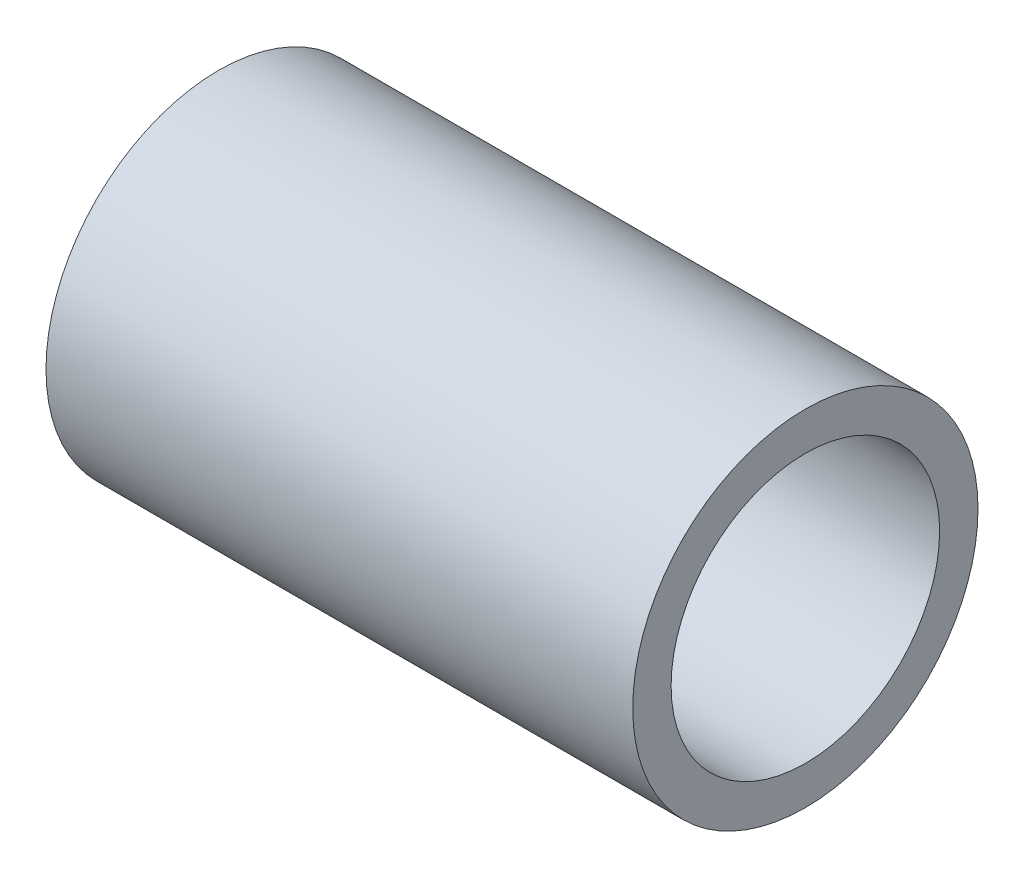
from build123d import *


with BuildPart() as part:
    # Sketch1 → Revolve1 (revolve)
    with BuildSketch(Plane.XY, mode=Mode.PRIVATE) as revolve1_sk:
        with BuildLine():
            Line((6.35, 14.2875), (54.912326353, 14.2875))
            Line((54.912326353, 14.2875), (54.912326353, 11.1125))
            Line((54.912326353, 11.1125), (16.812326353, 11.1125))
            Line((16.812326353, 11.1125), (6.346118551, 2.330308893))
            ThreePointArc((6.346118551, 2.330308893), (4.992463664, 1.662760177), (3.483517422, 1.695685502))
            Line((3.483517422, 1.695685502), (0, 2.629091182))
            Line((0, 2.629091182), (0, 4.60375))
            Line((0, 4.60375), (6.35, 4.60375))
            Line((6.35, 4.60375), (6.35, 14.2875))
        make_face()
    revolve(revolve1_sk.sketch.rotate(Axis((0, 0, 0), (1, 0, 0)), 90), axis=Axis((0, 0, 0), (1, 0, 0)))


solid = part.part
